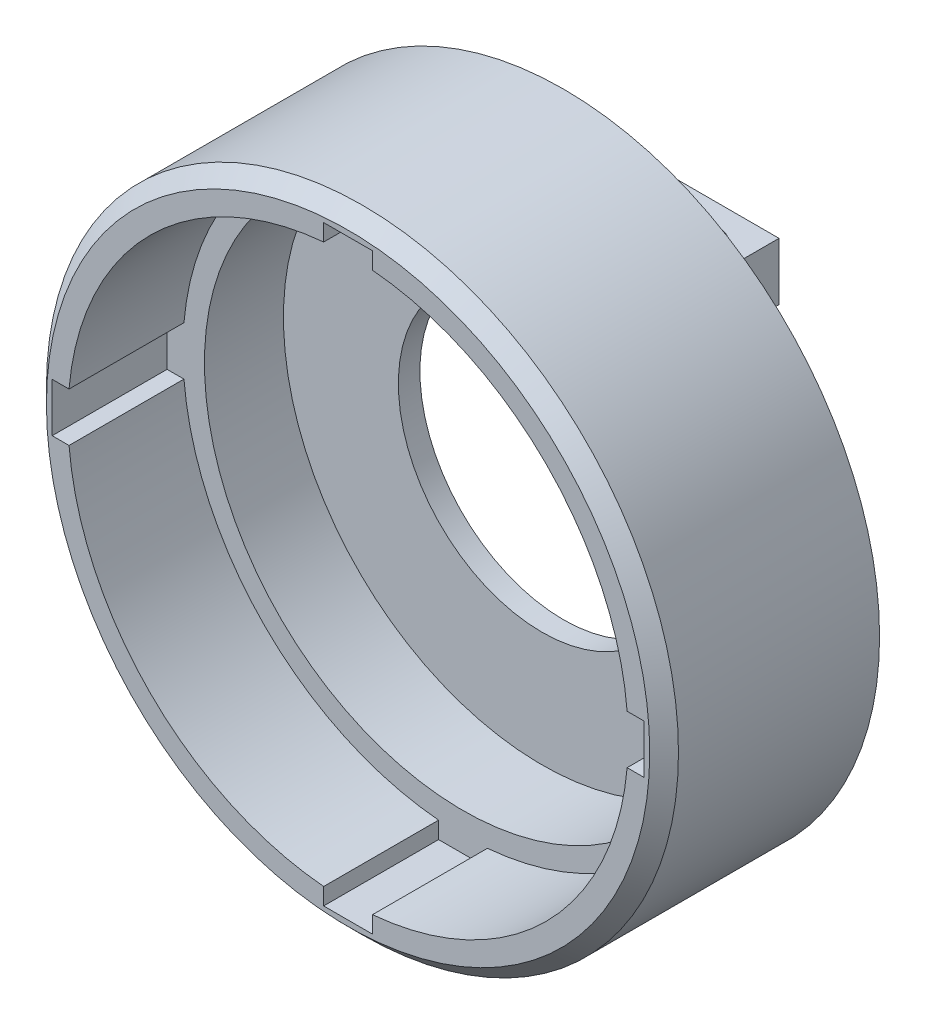
from build123d import *

# Parameters (mm, degrees)
SKETCH1_R               = 22
BOSS_EXTRUDE1_DEPTH     = 8.25
SKETCH2_R               = 18
CUT_EXTRUDE1_DEPTH      = 13.5
SKETCH3_R               = 19.5
CUT_EXTRUDE2_DEPTH      = 8
CUT_EXTRUDE3_DEPTH      = 36.217183306
CUT_EXTRUDE3_DEPTH_BACK = 36.217183306
SKETCH4_R               = 10
SKETCH6_W               = 3.4
SKETCH6_H               = 2.2
CUT_EXTRUDE5_DEPTH      = 8
CIRPATTERN1_COUNT       = 4
CUT_EXTRUDE6_START      = -1.5
SKETCH7_R               = 22
CUT_EXTRUDE6_DEPTH      = 1.5
CHAMFER1_SIZE           = 1
BOSS_EXTRUDE2_START     = 5
BOSS_EXTRUDE2_DEPTH     = 5
SKETCH9_W               = 10
SKETCH9_H               = 5
CUT_EXTRUDE7_DEPTH      = 37.986484018
SKETCH10_R              = 1
CUT_EXTRUDE8_DEPTH      = 42.764967377


with BuildPart() as part:
    # Sketch1 → Boss-Extrude1 (new, symmetric)
    with BuildSketch(Plane.XY):
        Circle(SKETCH1_R)
    extrude(amount=BOSS_EXTRUDE1_DEPTH, both=True)

    # Sketch2 → Cut-Extrude1 (cut)
    with BuildSketch(Plane.XY.offset(8.25)):
        Circle(SKETCH2_R)
    extrude(amount=-CUT_EXTRUDE1_DEPTH, mode=Mode.SUBTRACT)

    # Sketch3 → Cut-Extrude2 (cut)
    with BuildSketch(Plane.XY.offset(8.25)):
        Circle(SKETCH3_R)
    extrude(amount=-CUT_EXTRUDE2_DEPTH, mode=Mode.SUBTRACT)

    # Sketch4 → Cut-Extrude3 (cut, two sides: drawn at the far end of the back side and taken through both)
    with BuildSketch(Plane(origin=(0, 0, -8.25), x_dir=(-1, 0, 0), z_dir=(0, 0, -1)).offset(-CUT_EXTRUDE3_DEPTH_BACK)):
        with Locations(Location((0, 0, 0), (0, 0, 180))):
            Circle(SKETCH4_R)
    extrude(amount=CUT_EXTRUDE3_DEPTH + CUT_EXTRUDE3_DEPTH_BACK, mode=Mode.SUBTRACT)

    # Sketch6 → Cut-Extrude5 (cut)
    with BuildSketch(Plane.XY.offset(8.25)):
        with Locations((0, 19.5)):
            Rectangle(SKETCH6_W, SKETCH6_H)
    cut_extrude5 = extrude(amount=-CUT_EXTRUDE5_DEPTH, mode=Mode.SUBTRACT)

    # CirPattern1: Cut-Extrude5 ×4 about axis
    cirpattern1_axis = Axis((0, 0, 0), (0, 0, 1))
    for i in range(1, CIRPATTERN1_COUNT):
        add(cut_extrude5.rotate(cirpattern1_axis, i * 360 / CIRPATTERN1_COUNT), mode=Mode.SUBTRACT)

    # Sketch7 → Cut-Extrude6 (cut)
    with BuildSketch(Plane(origin=(0, 0, -8.25), x_dir=(-1, 0, 0), z_dir=(0, 0, -1)).offset(CUT_EXTRUDE6_START)):
        Circle(SKETCH7_R)
    extrude(amount=CUT_EXTRUDE6_DEPTH, mode=Mode.SUBTRACT)

    # Chamfer1
    chamfer1_edges = [part.edges().sort_by_distance(p)[0] for p in [
        (-22, 0, 8.25),
    ]]
    chamfer(chamfer1_edges, length=CHAMFER1_SIZE)

    # Sketch8 → Boss-Extrude2 (add)
    with BuildSketch(Plane(origin=(0, 0, -6.75), x_dir=(-1, 0, 0), z_dir=(0, 0, -1)).offset(BOSS_EXTRUDE2_START)):
        with BuildLine():
            Line((5, 9), (5, 11.5))
            Line((5, 11.5), (10, 11.5))
            Line((10, 11.5), (10, 15.5))
            Line((10, 15.5), (-10, 15.5))
            Line((-10, 15.5), (-10, 11.5))
            Line((-10, 11.5), (-5, 11.5))
            Line((-5, 11.5), (-5, 9))
            Line((-5, 9), (-4.358898944, 9))
            ThreePointArc((-4.358898944, 9), (0, 10), (4.358898944, 9))
            Line((4.358898944, 9), (5, 9))
        make_face()
    extrude(amount=-BOSS_EXTRUDE2_DEPTH)

    # Sketch9 → Cut-Extrude7 (cut, through all)
    with BuildSketch(Plane(origin=(0, 0, -11.75), x_dir=(-1, 0, 0), z_dir=(0, 0, -1))):
        with Locations((0, 11)):
            Rectangle(SKETCH9_W, SKETCH9_H)
    extrude(amount=-CUT_EXTRUDE7_DEPTH, mode=Mode.SUBTRACT)

    # Sketch10 → Cut-Extrude8 (cut, through all)
    with BuildSketch(Plane.XZ.offset(-11.5)):
        with Locations(Location((-7.5, -9.25, 0), (0, 0, 270))):
            Circle(SKETCH10_R)
        with Locations(Location((7.5, -9.25, 0), (0, 0, 180))):
            Circle(SKETCH10_R)
    extrude(amount=-CUT_EXTRUDE8_DEPTH, mode=Mode.SUBTRACT)


solid = part.part
